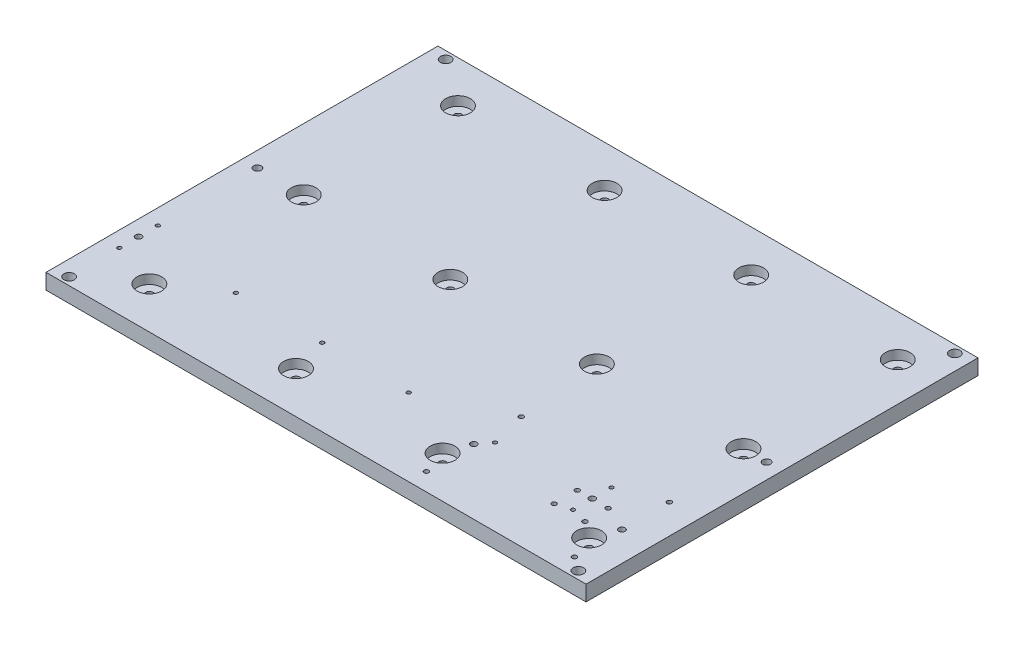
from build123d import *

# Parameters (mm, degrees)
SKETCH2_W           = 920
SKETCH2_H           = 264
BOSS_EXTRUDE1_DEPTH = 10
SKETCH1_R           = 2.5
CUT_EXTRUDE2_DEPTH  = 18
SKETCH3_R           = 8
CUT_EXTRUDE3_DEPTH  = 6
SKETCH4_W           = 570
SKETCH4_H           = 264
CUT_EXTRUDE4_DEPTH  = 20
SKETCH7_R           = 3.4
SKETCH7_R_2         = 2.5
CUT_EXTRUDE5_DEPTH  = 20
SKETCH8_W           = 350
SKETCH8_H           = 5
CUT_EXTRUDE6_DEPTH  = 10
SKETCH9_R           = 1.25
SKETCH9_R_2         = 2
CUT_EXTRUDE7_DEPTH  = 10
SKETCH10_R          = 1.5
SKETCH10_R_2        = 2
CUT_EXTRUDE8_DEPTH  = 10


with BuildPart() as part:
    # Sketch2 → Boss-Extrude1 (new body)
    with BuildSketch(Plane(origin=(0, 0, 0), x_dir=(1, 0, 0), z_dir=(0, 1, 0))):
        with Locations((460, 132)):
            Rectangle(SKETCH2_W, SKETCH2_H)
    extrude(amount=BOSS_EXTRUDE1_DEPTH)

    # Sketch1 → Cut-Extrude2 (cut)
    with BuildSketch(Plane(origin=(0, 10, 0), x_dir=(1, 0, 0), z_dir=(0, 1, 0))):
        with Locations(Location((40, 32, 0), (0, 0, 270))):
            Circle(SKETCH1_R)
        with Locations(Location((135, 32, 0), (0, 0, 270))):
            Circle(SKETCH1_R)
        with Locations(Location((230, 32, 0), (0, 0, 270))):
            Circle(SKETCH1_R)
        with Locations(Location((325, 32, 0), (0, 0, 270))):
            Circle(SKETCH1_R)
        with Locations(Location((420, 32, 0), (0, 0, 270))):
            Circle(SKETCH1_R)
        with Locations(Location((515, 32, 0), (0, 0, 270))):
            Circle(SKETCH1_R)
        with Locations(Location((610, 32, 0), (0, 0, 270))):
            Circle(SKETCH1_R)
        with Locations(Location((705, 32, 0), (0, 0, 270))):
            Circle(SKETCH1_R)
        with Locations(Location((800, 32, 0), (0, 0, 270))):
            Circle(SKETCH1_R)
        with Locations(Location((895, 32, 0), (0, 0, 270))):
            Circle(SKETCH1_R)
        with Locations(Location((135, 132, 0), (0, 0, 270))):
            Circle(SKETCH1_R)
        with Locations(Location((230, 132, 0), (0, 0, 270))):
            Circle(SKETCH1_R)
        with Locations(Location((325, 132, 0), (0, 0, 270))):
            Circle(SKETCH1_R)
        with Locations(Location((420, 132, 0), (0, 0, 270))):
            Circle(SKETCH1_R)
        with Locations(Location((515, 132, 0), (0, 0, 270))):
            Circle(SKETCH1_R)
        with Locations(Location((610, 132, 0), (0, 0, 270))):
            Circle(SKETCH1_R)
        with Locations(Location((705, 132, 0), (0, 0, 270))):
            Circle(SKETCH1_R)
        with Locations(Location((800, 132, 0), (0, 0, 270))):
            Circle(SKETCH1_R)
        with Locations(Location((895, 132, 0), (0, 0, 270))):
            Circle(SKETCH1_R)
        with Locations(Location((135, 232, 0), (0, 0, 270))):
            Circle(SKETCH1_R)
        with Locations(Location((230, 232, 0), (0, 0, 270))):
            Circle(SKETCH1_R)
        with Locations(Location((325, 232, 0), (0, 0, 270))):
            Circle(SKETCH1_R)
        with Locations(Location((420, 232, 0), (0, 0, 270))):
            Circle(SKETCH1_R)
        with Locations(Location((515, 232, 0), (0, 0, 270))):
            Circle(SKETCH1_R)
        with Locations(Location((610, 232, 0), (0, 0, 270))):
            Circle(SKETCH1_R)
        with Locations(Location((705, 232, 0), (0, 0, 270))):
            Circle(SKETCH1_R)
        with Locations(Location((800, 232, 0), (0, 0, 270))):
            Circle(SKETCH1_R)
        with Locations(Location((895, 232, 0), (0, 0, 270))):
            Circle(SKETCH1_R)
        with Locations(Location((40, 132, 0), (0, 0, 270))):
            Circle(SKETCH1_R)
        with Locations(Location((40, 232, 0), (0, 0, 270))):
            Circle(SKETCH1_R)
    extrude(amount=-CUT_EXTRUDE2_DEPTH, mode=Mode.SUBTRACT)

    # Sketch3 → Cut-Extrude3 (cut)
    with BuildSketch(Plane(origin=(0, 10, 0), x_dir=(1, 0, 0), z_dir=(0, 1, 0))):
        with Locations(Location((40, 32, 0), (0, 0, 270))):
            Circle(SKETCH3_R)
        with Locations(Location((135, 32, 0), (0, 0, 270))):
            Circle(SKETCH3_R)
        with Locations(Location((230, 32, 0), (0, 0, 270))):
            Circle(SKETCH3_R)
        with Locations(Location((325, 32, 0), (0, 0, 270))):
            Circle(SKETCH3_R)
        with Locations(Location((420, 32, 0), (0, 0, 270))):
            Circle(SKETCH3_R)
        with Locations(Location((515, 32, 0), (0, 0, 270))):
            Circle(SKETCH3_R)
        with Locations(Location((610, 32, 0), (0, 0, 270))):
            Circle(SKETCH3_R)
        with Locations(Location((705, 32, 0), (0, 0, 270))):
            Circle(SKETCH3_R)
        with Locations(Location((800, 32, 0), (0, 0, 270))):
            Circle(SKETCH3_R)
        with Locations(Location((895, 32, 0), (0, 0, 270))):
            Circle(SKETCH3_R)
        with Locations(Location((135, 132, 0), (0, 0, 270))):
            Circle(SKETCH3_R)
        with Locations(Location((230, 132, 0), (0, 0, 270))):
            Circle(SKETCH3_R)
        with Locations(Location((325, 132, 0), (0, 0, 270))):
            Circle(SKETCH3_R)
        with Locations(Location((420, 132, 0), (0, 0, 270))):
            Circle(SKETCH3_R)
        with Locations(Location((515, 132, 0), (0, 0, 270))):
            Circle(SKETCH3_R)
        with Locations(Location((610, 132, 0), (0, 0, 270))):
            Circle(SKETCH3_R)
        with Locations(Location((705, 132, 0), (0, 0, 270))):
            Circle(SKETCH3_R)
        with Locations(Location((800, 132, 0), (0, 0, 270))):
            Circle(SKETCH3_R)
        with Locations(Location((895, 132, 0), (0, 0, 270))):
            Circle(SKETCH3_R)
        with Locations(Location((135, 232, 0), (0, 0, 270))):
            Circle(SKETCH3_R)
        with Locations(Location((230, 232, 0), (0, 0, 270))):
            Circle(SKETCH3_R)
        with Locations(Location((325, 232, 0), (0, 0, 270))):
            Circle(SKETCH3_R)
        with Locations(Location((420, 232, 0), (0, 0, 270))):
            Circle(SKETCH3_R)
        with Locations(Location((515, 232, 0), (0, 0, 270))):
            Circle(SKETCH3_R)
        with Locations(Location((610, 232, 0), (0, 0, 270))):
            Circle(SKETCH3_R)
        with Locations(Location((705, 232, 0), (0, 0, 270))):
            Circle(SKETCH3_R)
        with Locations(Location((800, 232, 0), (0, 0, 270))):
            Circle(SKETCH3_R)
        with Locations(Location((895, 232, 0), (0, 0, 270))):
            Circle(SKETCH3_R)
        with Locations(Location((40, 132, 0), (0, 0, 270))):
            Circle(SKETCH3_R)
        with Locations(Location((40, 232, 0), (0, 0, 270))):
            Circle(SKETCH3_R)
    extrude(amount=-CUT_EXTRUDE3_DEPTH, mode=Mode.SUBTRACT)

    # Sketch4 → Cut-Extrude4 (cut)
    with BuildSketch(Plane(origin=(0, 10, 0), x_dir=(1, 0, 0), z_dir=(0, 1, 0))):
        with Locations((635, 132)):
            Rectangle(SKETCH4_W, SKETCH4_H)
    extrude(amount=-CUT_EXTRUDE4_DEPTH, mode=Mode.SUBTRACT)

    # Sketch7 → Cut-Extrude5 (cut)
    with BuildSketch(Plane(origin=(0, 10, 0), x_dir=(1, 0, 0), z_dir=(0, 1, 0))):
        with Locations(Location((10, 254, 0), (0, 0, 270))):
            Circle(SKETCH7_R)
        with Locations(Location((340, 254, 0), (0, 0, 270))):
            Circle(SKETCH7_R)
        with Locations(Location((340, 10, 0), (0, 0, 270))):
            Circle(SKETCH7_R)
        with Locations(Location((10, 10, 0), (0, 0, 270))):
            Circle(SKETCH7_R)
        with Locations(Location((10, 132, 0), (0, 0, 270))):
            Circle(SKETCH7_R_2)
        with Locations(Location((340, 132, 0), (0, 0, 270))):
            Circle(SKETCH7_R_2)
    extrude(amount=-CUT_EXTRUDE5_DEPTH, mode=Mode.SUBTRACT)

    # Sketch8 → Cut-Extrude6 (cut)
    with BuildSketch(Plane(origin=(0, 10, 0), x_dir=(1, 0, 0), z_dir=(0, 1, 0))):
        with Locations((175, 261.5)):
            Rectangle(SKETCH8_W, SKETCH8_H)
        with Locations((175, 2.5)):
            Rectangle(SKETCH8_W, SKETCH8_H)
    extrude(amount=-CUT_EXTRUDE6_DEPTH, mode=Mode.SUBTRACT)

    # Sketch9 → Cut-Extrude7 (cut)
    with BuildSketch(Plane(origin=(0, 10, 0), x_dir=(1, 0, 0), z_dir=(0, 1, 0))):
        with Locations(Location((10, 67.5, 0), (0, 0, 270))):
            Circle(SKETCH9_R)
        with Locations(Location((10, 42.5, 0), (0, 0, 270))):
            Circle(SKETCH9_R)
        with Locations(Location((304, 67.5, 0), (0, 0, 90))):
            Circle(SKETCH9_R)
        with Locations(Location((304, 42.5, 0), (0, 0, 90))):
            Circle(SKETCH9_R)
        with Locations(Location((73, 55, 0), (0, 0, 270))):
            Circle(SKETCH9_R)
        with Locations(Location((129, 55, 0), (0, 0, 270))):
            Circle(SKETCH9_R)
        with Locations(Location((185, 55, 0), (0, 0, 90))):
            Circle(SKETCH9_R)
        with Locations(Location((241, 55, 0), (0, 0, 90))):
            Circle(SKETCH9_R)
        with Locations(Location((10, 55, 0), (0, 0, 270))):
            Circle(SKETCH9_R_2)
        with Locations(Location((304, 55, 0), (0, 0, 90))):
            Circle(SKETCH9_R_2)
    extrude(amount=-CUT_EXTRUDE7_DEPTH, mode=Mode.SUBTRACT)

    # Sketch10 → Cut-Extrude8 (cut)
    with BuildSketch(Plane(origin=(0, 10, 0), x_dir=(1, 0, 0), z_dir=(0, 1, 0))):
        with Locations(Location((235, 78.013636364, 0), (0, 0, 270))):
            Circle(SKETCH10_R)
        with Locations(Location((235, 16.486363636, 0), (0, 0, 270))):
            Circle(SKETCH10_R)
        with Locations(Location((294.500010803, 39.75, 0), (0, 0, 270))):
            Circle(SKETCH10_R)
        with Locations(Location((314.500010803, 54.75, 0), (0, 0, 270))):
            Circle(SKETCH10_R)
        with Locations(Location((331, 16.486363636, 0), (0, 0, 270))):
            Circle(SKETCH10_R)
        with Locations(Location((331, 47.25, 0), (0, 0, 270))):
            Circle(SKETCH10_R_2)
        with Locations(Location((331, 78.013636364, 0), (0, 0, 270))):
            Circle(SKETCH10_R)
        with Locations(Location((235, 47.25, 0), (0, 0, 270))):
            Circle(SKETCH10_R_2)
        with Locations(Location((294.500010803, 54.75, 0), (0, 0, 270))):
            Circle(SKETCH10_R)
        with Locations(Location((314.500010803, 39.75, 0), (0, 0, 270))):
            Circle(SKETCH10_R)
    extrude(amount=-CUT_EXTRUDE8_DEPTH, mode=Mode.SUBTRACT)


solid = part.part
